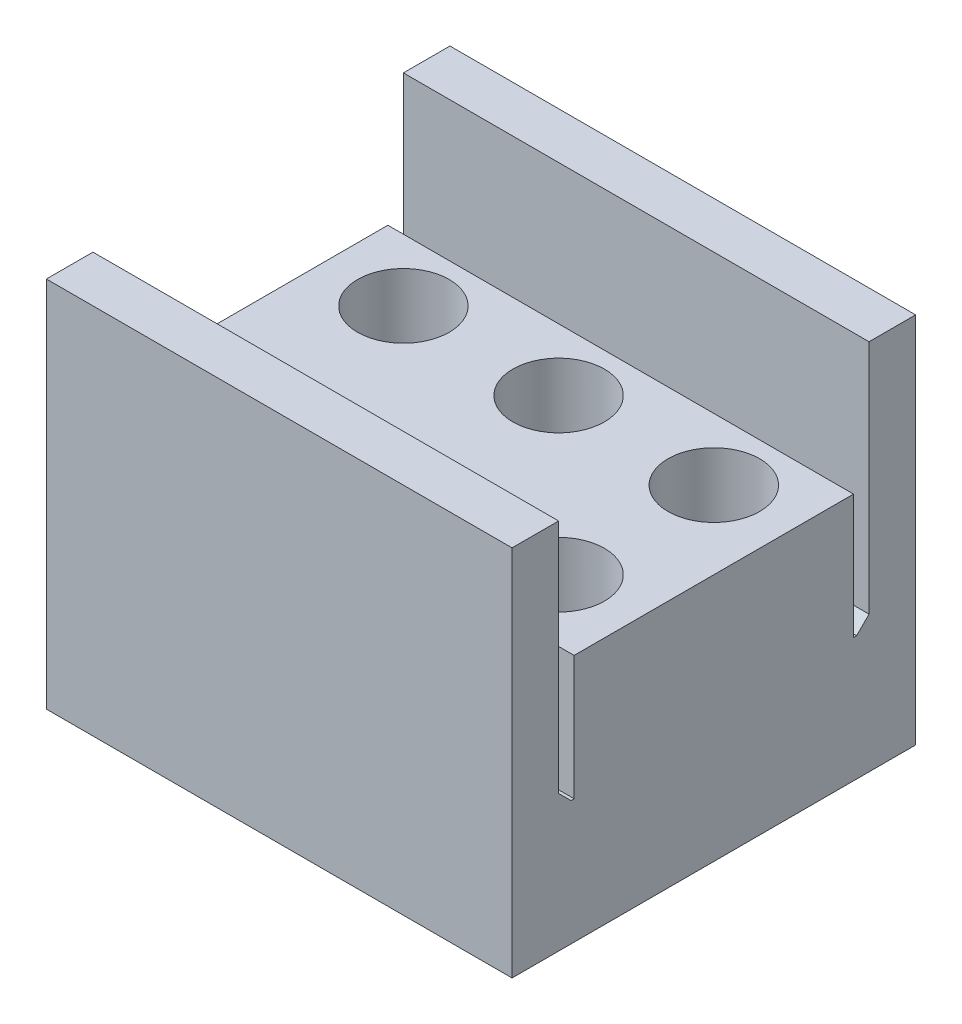
from build123d import *

# Parameters (mm, degrees)
SKETCH1_W            = 15
SKETCH1_H            = 13
BOSS_EXTRUDE1_DEPTH  = 8
SKETCH8_W            = 15
SKETCH8_H            = 1.5
BOSS_EXTRUDE4_DEPTH  = 4
SKETCH9_W            = 15
SKETCH9_H            = 0.5
CUT_EXTRUDE3_DEPTH   = 4
CHAMFER1_SIZE        = 0.4
SKETCH4_R            = 1.475
CUT_EXTRUDE2_DEPTH   = 8
LPATTERN1_COUNT      = 3
LPATTERN1_PITCH      = 5
LPATTERN1_COUNT_DIR2 = 2
LPATTERN1_PITCH_DIR2 = 5


with BuildPart() as part:
    # Sketch1 → Boss-Extrude1 (new body)
    with BuildSketch(Plane(origin=(0, 0, 0), x_dir=(1, 0, 0), z_dir=(0, 1, 0))):
        Rectangle(SKETCH1_W, SKETCH1_H)
    extrude(amount=BOSS_EXTRUDE1_DEPTH)

    # Sketch8 → Boss-Extrude4 (add)
    with BuildSketch(Plane(origin=(0, 8, 0), x_dir=(1, 0, 0), z_dir=(0, 1, 0))):
        with Locations((0, 5.75)):
            Rectangle(SKETCH8_W, SKETCH8_H)
        with Locations((0, -5.75)):
            Rectangle(SKETCH8_W, SKETCH8_H)
    extrude(amount=BOSS_EXTRUDE4_DEPTH)

    # Sketch9 → Cut-Extrude3 (cut)
    with BuildSketch(Plane(origin=(0, 8, 0), x_dir=(1, 0, 0), z_dir=(0, 1, 0))):
        with Locations((0, 4.75)):
            Rectangle(SKETCH9_W, SKETCH9_H)
        with Locations((0, -4.75)):
            Rectangle(SKETCH9_W, SKETCH9_H)
    extrude(amount=-CUT_EXTRUDE3_DEPTH, mode=Mode.SUBTRACT)

    # Chamfer1
    chamfer1_edges = [part.edges().sort_by_distance(p)[0] for p in [
        (0, 4, -5),
        (0, 4, 5),
    ]]
    chamfer(chamfer1_edges, length=CHAMFER1_SIZE)

    # Sketch4 → Cut-Extrude2 (cut)
    with BuildSketch(Plane.XZ):
        with Locations(Location((-5, 2.5, 0), (0, 0, 270))):
            Circle(SKETCH4_R)
    cut_extrude2 = extrude(amount=-CUT_EXTRUDE2_DEPTH, mode=Mode.SUBTRACT)

    # LPattern1: Cut-Extrude2 3 × 2
    with Locations(*[(i * LPATTERN1_PITCH, 0, -j * LPATTERN1_PITCH_DIR2) for i in range(LPATTERN1_COUNT) for j in range(LPATTERN1_COUNT_DIR2) if (i, j) != (0, 0)]):
        add(cut_extrude2, mode=Mode.SUBTRACT)


solid = part.part
